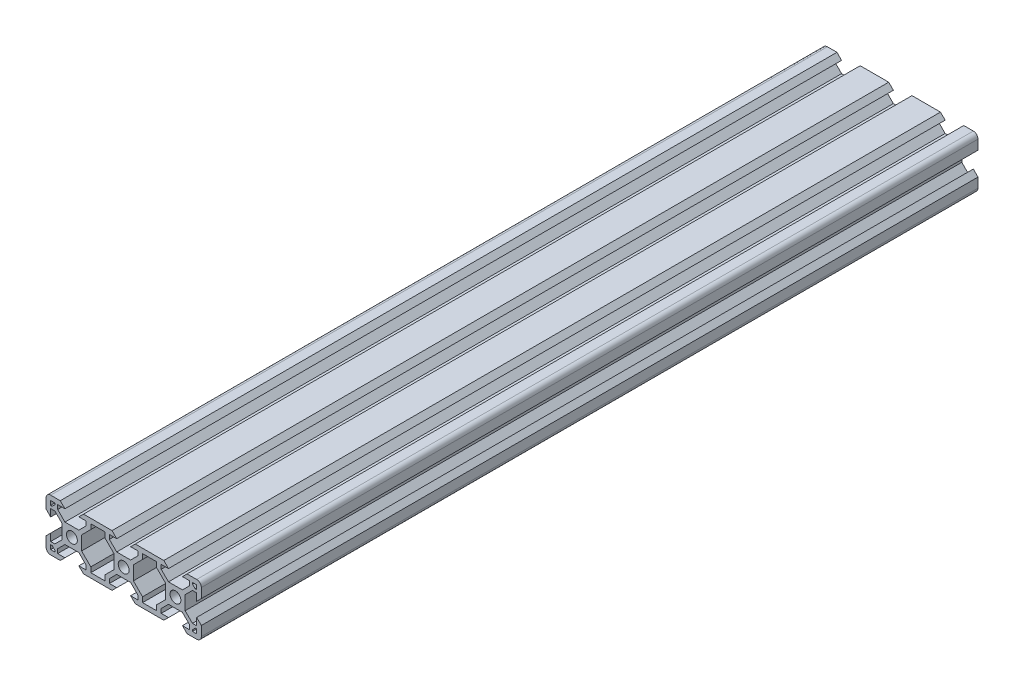
from build123d import *

# Parameters (mm, degrees)
ESQUISSE1_R        = 2.1
BOSS_EXTRU_1_DEPTH = 150


with BuildPart() as part:
    # Esquisse1 → Boss.-Extru.1 (new, symmetric)
    with BuildSketch(Plane.XY):
        with BuildLine():
            Line((-20, 3.750660172), (-22.69, 3.750660172))
            Line((-22.69, 3.750660172), (-25.499339828, 6.56))
            Line((-25.499339828, 6.56), (-25.499339828, 8.2))
            Line((-25.499339828, 8.2), (-22.69, 8.2))
            Line((-22.69, 8.2), (-24.49, 10))
            Line((-24.49, 10), (-28.2, 10))
            ThreePointArc((-28.2, 10), (-29.472792206, 9.472792206), (-30, 8.2))
            Line((-30, 8.2), (-30, 4.49))
            Line((-30, 4.49), (-28.2, 2.69))
            Line((-28.2, 2.69), (-28.2, 5.499339828))
            Line((-28.2, 5.499339828), (-26.56, 5.499339828))
            Line((-26.56, 5.499339828), (-23.750660172, 2.69))
            Line((-23.750660172, 2.69), (-23.750660172, 0))
            Line((-23.750660172, 0), (-23.750660172, -2.69))
            Line((-23.750660172, -2.69), (-26.56, -5.499339828))
            Line((-26.56, -5.499339828), (-28.2, -5.499339828))
            Line((-28.2, -5.499339828), (-28.2, -2.69))
            Line((-28.2, -2.69), (-30, -4.49))
            Line((-30, -4.49), (-30, -8.2))
            ThreePointArc((-30, -8.2), (-29.472792206, -9.472792206), (-28.2, -10))
            Line((-28.2, -10), (-24.49, -10))
            Line((-24.49, -10), (-22.69, -8.2))
            Line((-22.69, -8.2), (-25.499339828, -8.2))
            Line((-25.499339828, -8.2), (-25.499339828, -6.56))
            Line((-25.499339828, -6.56), (-22.69, -3.750660172))
            Line((-22.69, -3.750660172), (-20, -3.750660172))
            Line((-20, -3.750660172), (-17.31, -3.750660172))
            Line((-17.31, -3.750660172), (-14.500660172, -6.56))
            Line((-14.500660172, -6.56), (-14.500660172, -8.2))
            Line((-14.500660172, -8.2), (-17.31, -8.2))
            Line((-17.31, -8.2), (-15.51, -10))
            Line((-15.51, -10), (-4.49, -10))
            Line((-4.49, -10), (-2.69, -8.2))
            Line((-2.69, -8.2), (-5.499339828, -8.2))
            Line((-5.499339828, -8.2), (-5.499339828, -6.56))
            Line((-5.499339828, -6.56), (-2.69, -3.750660172))
            Line((-2.69, -3.750660172), (2.69, -3.750660172))
            Line((2.69, -3.750660172), (5.499339828, -6.56))
            Line((5.499339828, -6.56), (5.499339828, -8.2))
            Line((5.499339828, -8.2), (2.69, -8.2))
            Line((2.69, -8.2), (4.49, -10))
            Line((4.49, -10), (15.51, -10))
            Line((15.51, -10), (17.31, -8.2))
            Line((17.31, -8.2), (14.500660172, -8.2))
            Line((14.500660172, -8.2), (14.500660172, -6.56))
            Line((14.500660172, -6.56), (17.31, -3.750660172))
            Line((17.31, -3.750660172), (20, -3.750660172))
            Line((20, -3.750660172), (22.69, -3.750660172))
            Line((22.69, -3.750660172), (25.499339828, -6.56))
            Line((25.499339828, -6.56), (25.499339828, -8.2))
            Line((25.499339828, -8.2), (22.69, -8.2))
            Line((22.69, -8.2), (24.49, -10))
            Line((24.49, -10), (28.2, -10))
            ThreePointArc((28.2, -10), (29.472792206, -9.472792206), (30, -8.2))
            Line((30, -8.2), (30, -4.49))
            Line((30, -4.49), (28.2, -2.69))
            Line((28.2, -2.69), (28.2, -5.499339828))
            Line((28.2, -5.499339828), (26.56, -5.499339828))
            Line((26.56, -5.499339828), (23.750660172, -2.69))
            Line((23.750660172, -2.69), (23.750660172, 0))
            Line((23.750660172, 0), (23.750660172, 2.69))
            Line((23.750660172, 2.69), (26.56, 5.499339828))
            Line((26.56, 5.499339828), (28.2, 5.499339828))
            Line((28.2, 5.499339828), (28.2, 2.69))
            Line((28.2, 2.69), (30, 4.49))
            Line((30, 4.49), (30, 8.2))
            ThreePointArc((30, 8.2), (29.472792206, 9.472792206), (28.2, 10))
            Line((28.2, 10), (24.49, 10))
            Line((24.49, 10), (22.69, 8.2))
            Line((22.69, 8.2), (25.499339828, 8.2))
            Line((25.499339828, 8.2), (25.499339828, 6.56))
            Line((25.499339828, 6.56), (22.69, 3.750660172))
            Line((22.69, 3.750660172), (20, 3.750660172))
            Line((20, 3.750660172), (17.31, 3.750660172))
            Line((17.31, 3.750660172), (14.500660172, 6.56))
            Line((14.500660172, 6.56), (14.500660172, 8.2))
            Line((14.500660172, 8.2), (17.31, 8.2))
            Line((17.31, 8.2), (15.51, 10))
            Line((15.51, 10), (4.49, 10))
            Line((4.49, 10), (2.69, 8.2))
            Line((2.69, 8.2), (5.499339828, 8.2))
            Line((5.499339828, 8.2), (5.499339828, 6.56))
            Line((5.499339828, 6.56), (2.69, 3.750660172))
            Line((2.69, 3.750660172), (-2.69, 3.750660172))
            Line((-2.69, 3.750660172), (-5.499339828, 6.56))
            Line((-5.499339828, 6.56), (-5.499339828, 8.2))
            Line((-5.499339828, 8.2), (-2.69, 8.2))
            Line((-2.69, 8.2), (-4.49, 10))
            Line((-4.49, 10), (-15.51, 10))
            Line((-15.51, 10), (-17.31, 8.2))
            Line((-17.31, 8.2), (-14.500660172, 8.2))
            Line((-14.500660172, 8.2), (-14.500660172, 6.56))
            Line((-14.500660172, 6.56), (-17.31, 3.750660172))
            Line((-17.31, 3.750660172), (-20, 3.750660172))
        make_face()
        Circle(ESQUISSE1_R, mode=Mode.SUBTRACT)
        with Locations((-20, 0)):
            Circle(ESQUISSE1_R, mode=Mode.SUBTRACT)
        with Locations((20, 0)):
            Circle(ESQUISSE1_R, mode=Mode.SUBTRACT)
        Polygon((-28.2, 8.2), (-28.2, 6.569339828), (-27.63, 6.569339828), (-26.569339828, 7.63), (-26.569339828, 8.2), align=None, mode=Mode.SUBTRACT)
        Polygon((-26.569339828, -7.63), (-27.63, -6.569339828), (-28.2, -6.569339828), (-28.2, -8.2), (-26.569339828, -8.2), align=None, mode=Mode.SUBTRACT)
        Polygon((-7.300660172, -8.2), (-7.300660172, -6.24), (-3.750660172, -2.69), (-3.750660172, 2.69), (-7.300660172, 6.24), (-7.300660172, 8.2), (-12.699339828, 8.2), (-12.699339828, 6.24), (-16.249339828, 2.69), (-16.249339828, -2.69), (-12.699339828, -6.24), (-12.699339828, -8.2), align=None, mode=Mode.SUBTRACT)
        Polygon((26.569339828, 8.2), (28.2, 8.2), (28.2, 6.569339828), (27.63, 6.569339828), (26.569339828, 7.63), align=None, mode=Mode.SUBTRACT)
        Polygon((26.569339828, -8.2), (26.569339828, -7.63), (27.63, -6.569339828), (28.2, -6.569339828), (28.2, -8.2), align=None, mode=Mode.SUBTRACT)
        Polygon((7.300660172, 8.2), (7.300660172, 6.24), (3.750660172, 2.69), (3.750660172, -2.69), (7.300660172, -6.24), (7.300660172, -8.2), (12.699339828, -8.2), (12.699339828, -6.24), (16.249339828, -2.69), (16.249339828, 2.69), (12.699339828, 6.24), (12.699339828, 8.2), align=None, mode=Mode.SUBTRACT)
    extrude(amount=BOSS_EXTRU_1_DEPTH, both=True)


solid = part.part
